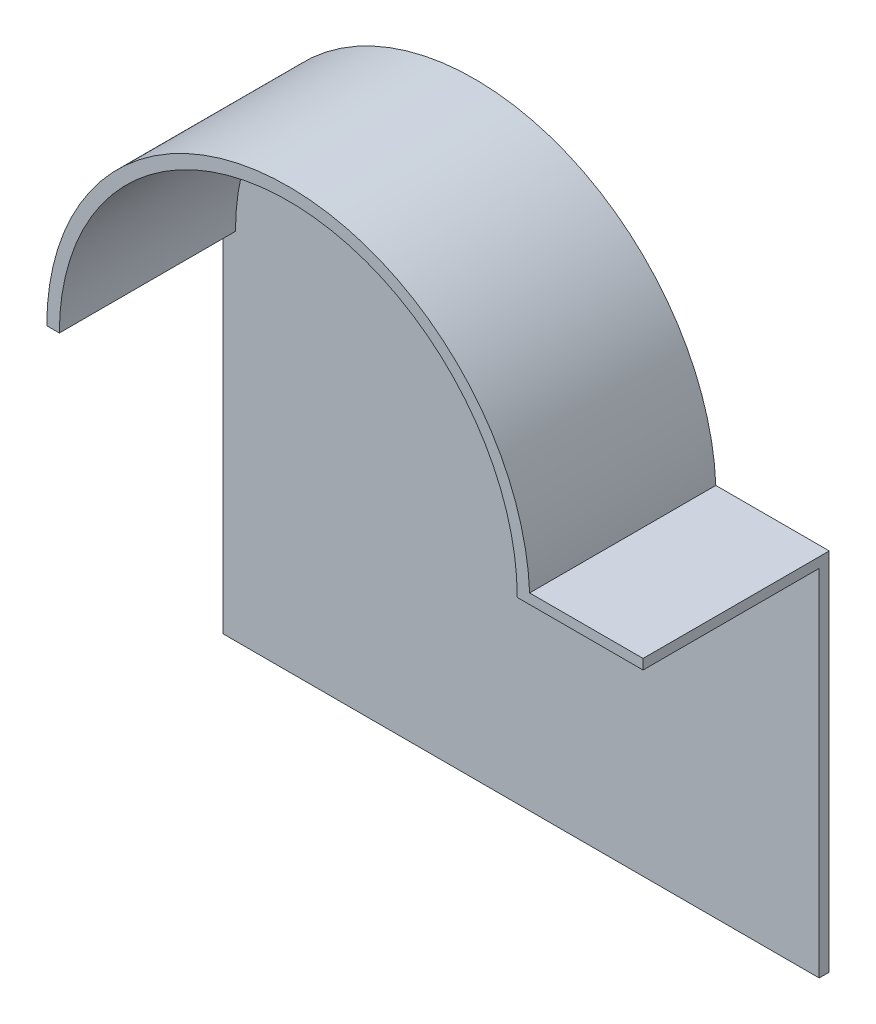
from build123d import *

# Parameters (mm, degrees)
BOSS_EXTRU_1_DEPTH      = 2
BOSS_EXTRU_2_DEPTH      = 35
BOSS_EXTRU_3_REACH      = 144.764
BOSS_EXTRU_3_END_RADIUS = 48
ESQUISSE4_W             = 37
ESQUISSE4_H             = 2


with BuildPart() as part:
    # Esquisse1 → Boss.-Extru.1 (new body)
    with BuildSketch(Plane.XY):
        with BuildLine():
            Line((-48, 0), (-48, -68))
            Line((-48, -68), (-48, -70.5))
            Line((-48, -70.5), (70.5, -70.5))
            Line((70.5, -70.5), (70.5, -68))
            Line((70.5, -68), (70.5, 0))
            Line((70.5, 0), (68, 0))
            Line((68, 0), (48, 0))
            ThreePointArc((48, 0), (0, 48), (-48, 0))
        make_face()
    extrude(amount=BOSS_EXTRU_1_DEPTH)

    # Esquisse3 → Boss.-Extru.2 (add)
    with BuildSketch(Plane.XY.offset(2)):
        with BuildLine():
            Line((-45.5, 0), (-48, 0))
            ThreePointArc((-48, 0), (0, 48), (48, 0))
            Line((48, 0), (45.5, 0))
            ThreePointArc((45.5, 0), (0, 45.5), (-45.5, 0))
        make_face()
    extrude(amount=BOSS_EXTRU_2_DEPTH)

    # Boss.-Extru.3: up to this cylinder (the profile starts outside it)
    boss_extru_3_end = Plane(origin=(0, 0, 18.5), z_dir=(0, 0, -1)) * Cylinder(BOSS_EXTRU_3_END_RADIUS, 386.528, mode=Mode.PRIVATE)
    # Esquisse4 → Boss.-Extru.3 (add, up to the surface)
    with BuildSketch(Plane(origin=(70.5, 0, 0), x_dir=(0, 0, -1), z_dir=(1, 0, 0)), mode=Mode.PRIVATE) as boss_extru_3_sk1:
        with Locations((-18.5, 1)):
            Rectangle(ESQUISSE4_W, ESQUISSE4_H)
    boss_extru_3_tool1 = extrude(boss_extru_3_sk1.sketch, amount=-BOSS_EXTRU_3_REACH, mode=Mode.PRIVATE) - boss_extru_3_end
    add(boss_extru_3_tool1.solids().sort_by_distance((70.5, 1, 18.5))[0])


solid = part.part
